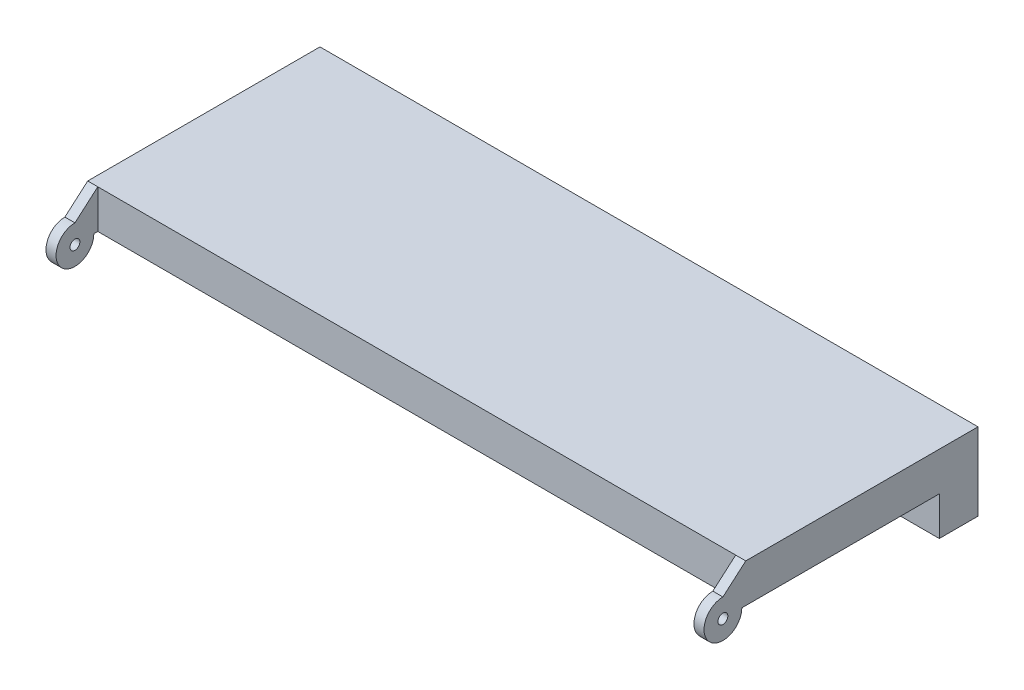
from build123d import *

# Parameters (mm, degrees)
SKETCH1_W             = 85
SKETCH1_H             = 30
TOP_SURFACE_DEPTH     = 10
SKETCH6_W             = 25
SKETCH6_H             = 5
TOP_SURFACE_CUT_DEPTH = 91.691785736
SKETCH16_R            = 0.64
BOSS_EXTRUDE14_DEPTH  = 1.3
LPATTERN3_COUNT       = 2
LPATTERN3_PITCH       = 83.7


with BuildPart() as part:
    # Sketch1 → Top surface (new body)
    with BuildSketch(Plane(origin=(0, 0, 0), x_dir=(1, 0, 0), z_dir=(0, 1, 0))):
        with Locations((42.5, 15)):
            Rectangle(SKETCH1_W, SKETCH1_H)
    extrude(amount=TOP_SURFACE_DEPTH)

    # Sketch6 → Top surface cut (cut, through all)
    with BuildSketch(Plane.ZY):
        with Locations((-12.5, 2.5)):
            Rectangle(SKETCH6_W, SKETCH6_H)
    extrude(amount=-TOP_SURFACE_CUT_DEPTH, mode=Mode.SUBTRACT)

    # Sketch16 → Boss-Extrude14 (add)
    with BuildSketch(Plane.ZY):
        with BuildLine():
            Line((0, 10), (0, 5))
            Line((0, 5), (0.51, 5))
            ThreePointArc((0.51, 5), (4.675340546, 3.274659454), (2.95, 7.44))
            Line((2.95, 7.44), (0, 10))
        make_face()
        with Locations((2.95, 5)):
            Circle(SKETCH16_R, mode=Mode.SUBTRACT)
    boss_extrude14 = extrude(amount=-BOSS_EXTRUDE14_DEPTH)

    # LPattern3: Boss-Extrude14 ×2
    with Locations(*[(i * LPATTERN3_PITCH, 0, 0) for i in range(1, LPATTERN3_COUNT)]):
        add(boss_extrude14)


solid = part.part
